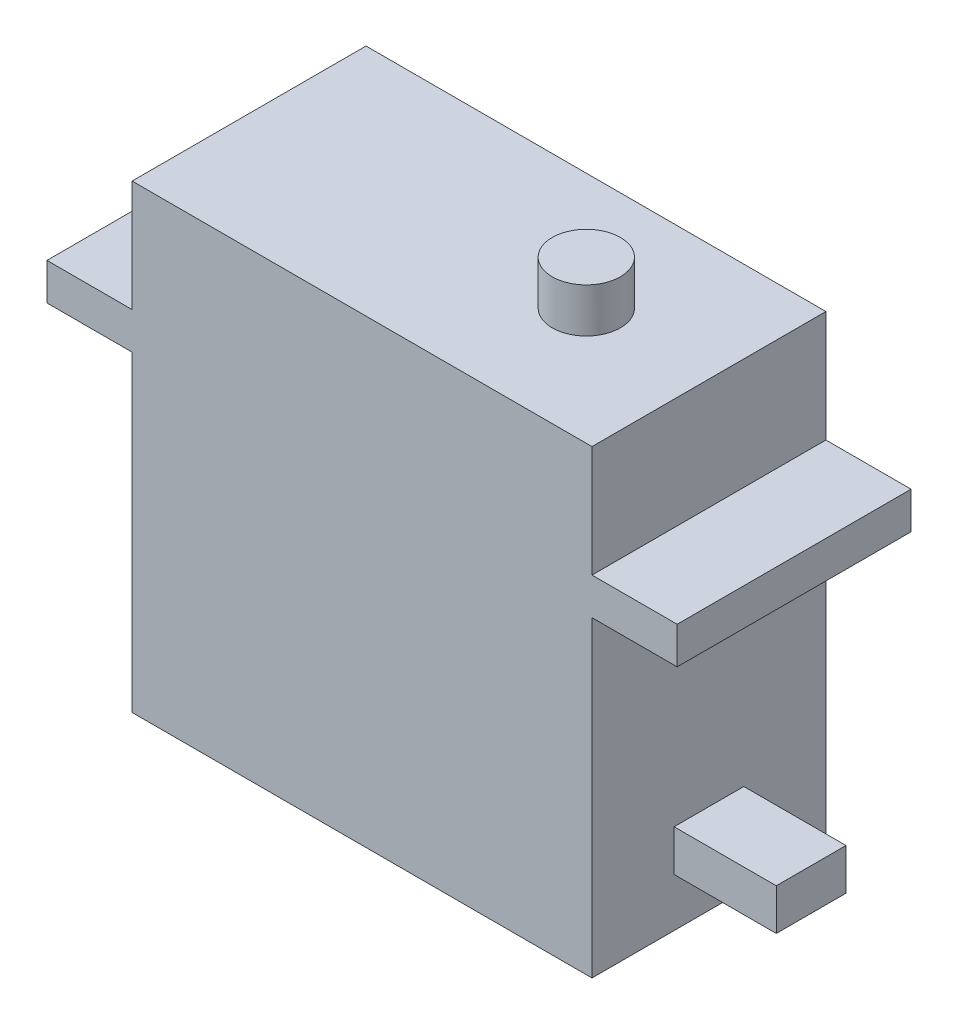
from build123d import *

# Parameters (mm, degrees)
SKETCH1_W           = 40.5
SKETCH1_H           = 40.53
BOSS_EXTRUDE1_DEPTH = 20.6
BOSS_EXTRUDE2_START = -9.8
SKETCH2_W           = 7.5
SKETCH2_H           = 20.6
BOSS_EXTRUDE2_DEPTH = 3.25
SKETCH3_R           = 3
BOSS_EXTRUDE3_DEPTH = 3.9
SKETCH4_W           = 6.14
SKETCH4_H           = 3.64
BOSS_EXTRUDE4_DEPTH = 9


with BuildPart() as part:
    # Sketch1 → Boss-Extrude1 (new body)
    with BuildSketch(Plane.XY):
        Rectangle(SKETCH1_W, SKETCH1_H)
    extrude(amount=BOSS_EXTRUDE1_DEPTH)

    # Sketch2 → Boss-Extrude2 (add)
    with BuildSketch(Plane(origin=(0, 20.265, 0), x_dir=(1, 0, 0), z_dir=(0, 1, 0)).offset(BOSS_EXTRUDE2_START)):
        with Locations((-24, -10.3)):
            Rectangle(SKETCH2_W, SKETCH2_H)
        with Locations((24, -10.3)):
            Rectangle(SKETCH2_W, SKETCH2_H)
    extrude(amount=-BOSS_EXTRUDE2_DEPTH)

    # Sketch3 → Boss-Extrude3 (add)
    with BuildSketch(Plane(origin=(0, 20.265, 0), x_dir=(1, 0, 0), z_dir=(0, 1, 0))):
        with Locations(Location((9.45, -10.3, 0), (0, 0, 90))):
            Circle(SKETCH3_R)
    extrude(amount=BOSS_EXTRUDE3_DEPTH)

    # Sketch4 → Boss-Extrude4 (add)
    with BuildSketch(Plane(origin=(20.25, 0, 0), x_dir=(0, 0, -1), z_dir=(1, 0, 0))):
        with Locations((-10.3, -14.165)):
            Rectangle(SKETCH4_W, SKETCH4_H)
    extrude(amount=BOSS_EXTRUDE4_DEPTH)


solid = part.part
